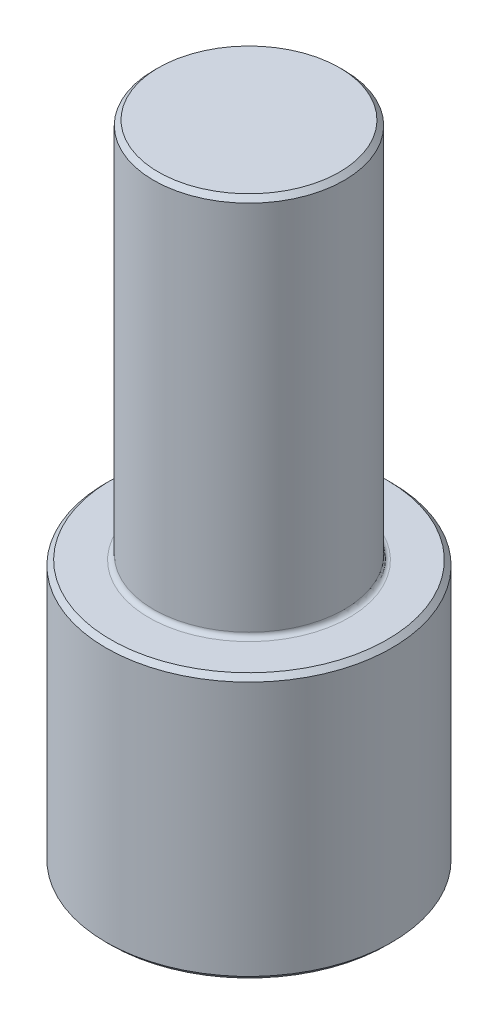
from build123d import *

# Parameters (mm, degrees)
M4_TAPPED_HOLE1_D     = 3.3
M4_TAPPED_HOLE1_DEPTH = 12
M4_TAPPED_HOLE1_TIP   = 0.991420021
FILLET1_R             = 0.2
CHAMFER1_SIZE         = 0.2


with BuildPart() as part:
    # Sketch1 → Revolve1 (revolve)
    with BuildSketch(Plane.XY, mode=Mode.PRIVATE) as revolve1_sk:
        Polygon((0, 0), (6, 0), (6, 11.1), (4, 11.1), (4, 27.1), (0, 27.1), align=None)
    revolve(revolve1_sk.sketch.rotate(Axis((0, 7.476190476, 0), (0, -1, 0)), 90), axis=Axis((0, 7.476190476, 0), (0, -1, 0)))

    # M4 Tapped Hole1
    with Locations(Plane(origin=(0, 0, 0), x_dir=(-1, 0, 0), z_dir=(0, -1, 0))):
        with Locations((0, 0)):
            Hole(M4_TAPPED_HOLE1_D / 2, depth=M4_TAPPED_HOLE1_DEPTH)
            with Locations((0, 0, -(M4_TAPPED_HOLE1_DEPTH + M4_TAPPED_HOLE1_TIP / 2))):  # 118° drill point
                Cone(0, M4_TAPPED_HOLE1_D / 2, M4_TAPPED_HOLE1_TIP, mode=Mode.SUBTRACT)

    # Fillet1
    fillet1_edges = [part.edges().sort_by_distance(p)[0] for p in [
        (0, 11.1, -4),
    ]]
    fillet(fillet1_edges, radius=FILLET1_R)

    # Chamfer1
    chamfer1_edges = [part.edges().sort_by_distance(p)[0] for p in [
        (0, 27.1, -4),
        (0, 11.1, -6),
        (0, 0, -6),
    ]]
    chamfer(chamfer1_edges, length=CHAMFER1_SIZE)


solid = part.part
